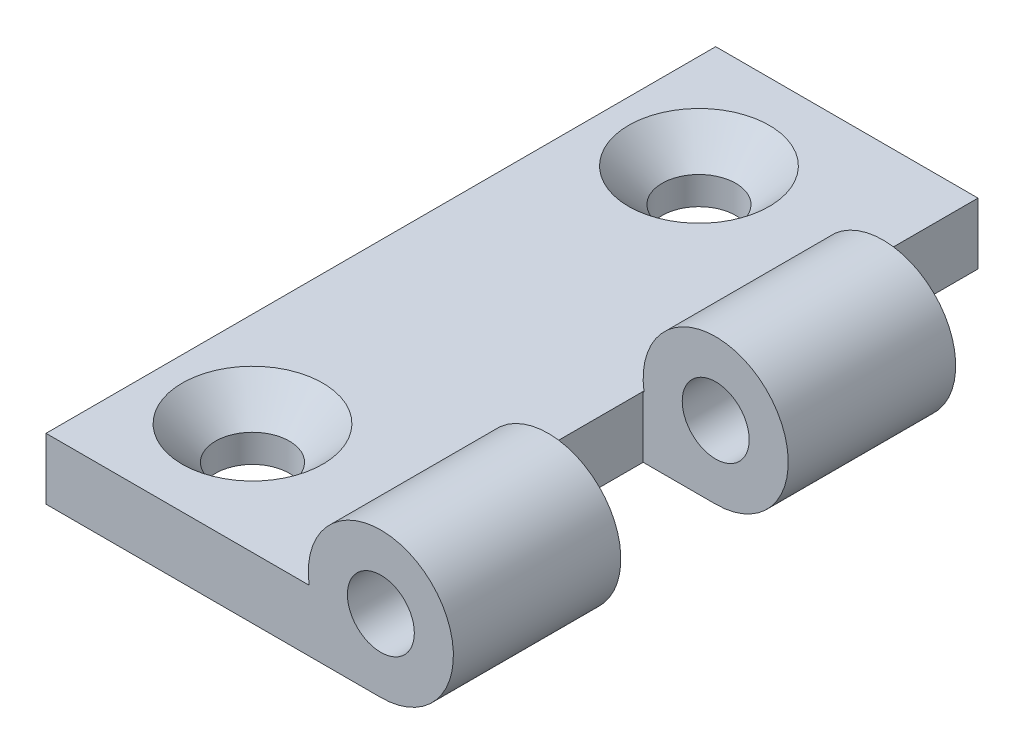
from build123d import *

# Parameters (mm, degrees)
SKETCH1_R                                    = 6.5
SKETCH1_R_2                                  = 3
BOSS_EXTRUDE1_DEPTH                          = 30
CSK_FOR_M6_COUNTERSUNK_FLAT_HEAD_SCR_2_COUNT = 2
CSK_FOR_M6_COUNTERSUNK_FLAT_HEAD_SCR_2_PITCH = 40
CUT_EXTRUDE1_DEPTH                           = 43.921439864
CUT_EXTRUDE1_DEPTH_BACK                      = 43.921439864
SKETCH4_W                                    = 13
SKETCH4_H                                    = 15


with BuildPart() as part:
    # Sketch1 → Boss-Extrude1 (new, symmetric)
    # profile 1 of 2: a face of its own
    with BuildSketch(Plane.XY):
        with BuildLine():
            Line((-30, -6.5), (0, -6.5))
            ThreePointArc((0, -6.5), (-4.227883631, -4.937104415), (-6.422616289, -1))
            Line((-6.422616289, -1), (-30, -1))
            Line((-30, -1), (-30, -6.5))
        make_face()
    # profile 2 of 2: a face of its own
    with BuildSketch(Plane.XY):
        Circle(SKETCH1_R)
        Circle(SKETCH1_R_2, mode=Mode.SUBTRACT)
    extrude(amount=BOSS_EXTRUDE1_DEPTH, both=True)

    # Sketch3 → CSK for M6 Countersunk Flat Head Screw1 (revolve, cut)
    with BuildSketch(Plane(origin=(-21.5, -1, -20), x_dir=(0, 0, 1), z_dir=(1, 0, 0))):
        Polygon((0, 0), (0, 5.5), (3.3, 5.5), (3.3, 3), (6.3, 0), align=None)
    csk_for_m6_countersunk_flat_head_screw1 = revolve(axis=Axis((-21.5, 5.35, -20), (0, -1, 0)), mode=Mode.SUBTRACT)

    # CSK for M6 Countersunk Flat Head Scr 2: CSK for M6 Countersunk Flat Head Screw1 ×2
    with Locations(*[(0, 0, i * CSK_FOR_M6_COUNTERSUNK_FLAT_HEAD_SCR_2_PITCH) for i in range(1, CSK_FOR_M6_COUNTERSUNK_FLAT_HEAD_SCR_2_COUNT)]):
        add(csk_for_m6_countersunk_flat_head_screw1, mode=Mode.SUBTRACT)

    # Sketch4 → Cut-Extrude1 (cut, two sides: drawn at the far end of the back side and taken through both)
    with BuildSketch(Plane(origin=(0, 0, 0), x_dir=(1, 0, 0), z_dir=(0, 1, 0)).offset(-CUT_EXTRUDE1_DEPTH_BACK)):
        with Locations((0, 22.5)):
            Rectangle(SKETCH4_W, SKETCH4_H)
        with Locations((0, -7.5)):
            Rectangle(SKETCH4_W, SKETCH4_H)
    extrude(amount=CUT_EXTRUDE1_DEPTH + CUT_EXTRUDE1_DEPTH_BACK, mode=Mode.SUBTRACT)


solid = part.part
